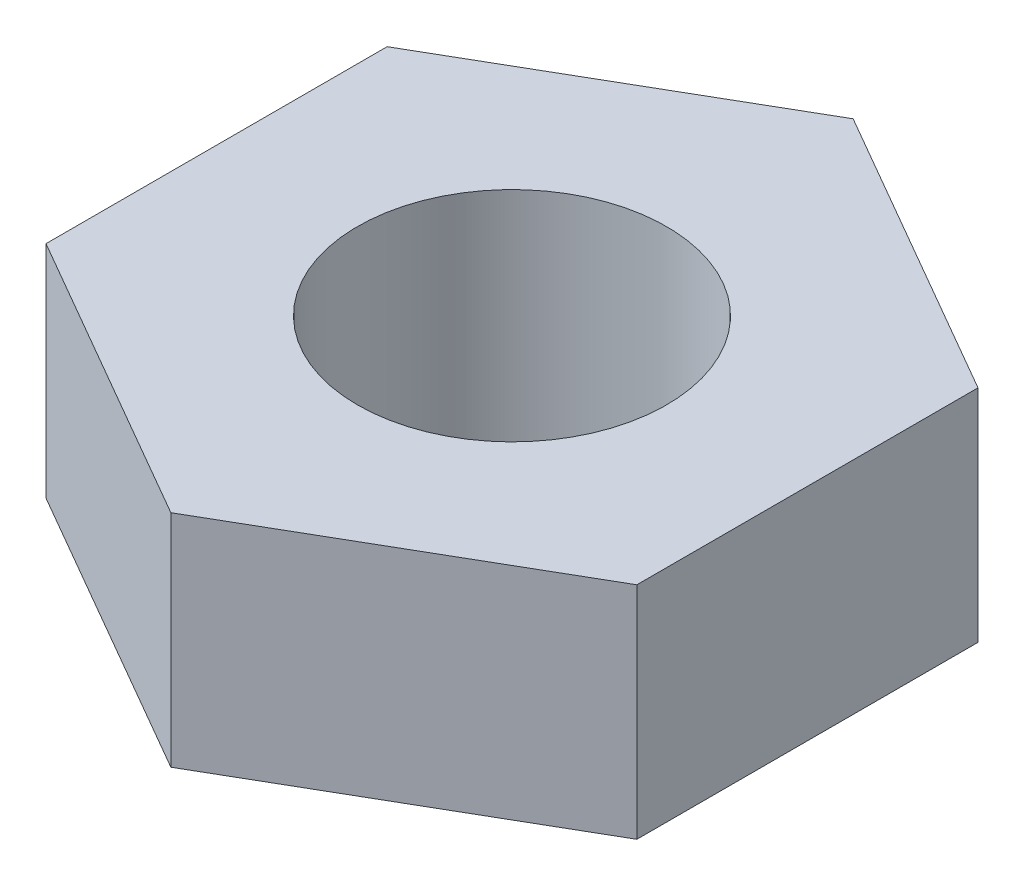
from build123d import *

# Parameters (mm, degrees)
CROQUIS1_R              = 3.4
SALIENTE_EXTRUIR1_DEPTH = 4.85


with BuildPart() as part:
    # Croquis1 → Saliente-Extruir1 (new body)
    with BuildSketch(Plane(origin=(0, 0, 0), x_dir=(1, 0, 0), z_dir=(0, 1, 0))):
        Polygon((0, -7.505553499), (6.5, -3.75277675), (6.5, 3.75277675), (0, 7.505553499), (-6.5, 3.75277675), (-6.5, -3.75277675), align=None)
        with Locations(Location((0, 0, 0), (0, 0, 270))):
            Circle(CROQUIS1_R, mode=Mode.SUBTRACT)
    extrude(amount=SALIENTE_EXTRUIR1_DEPTH)


solid = part.part
